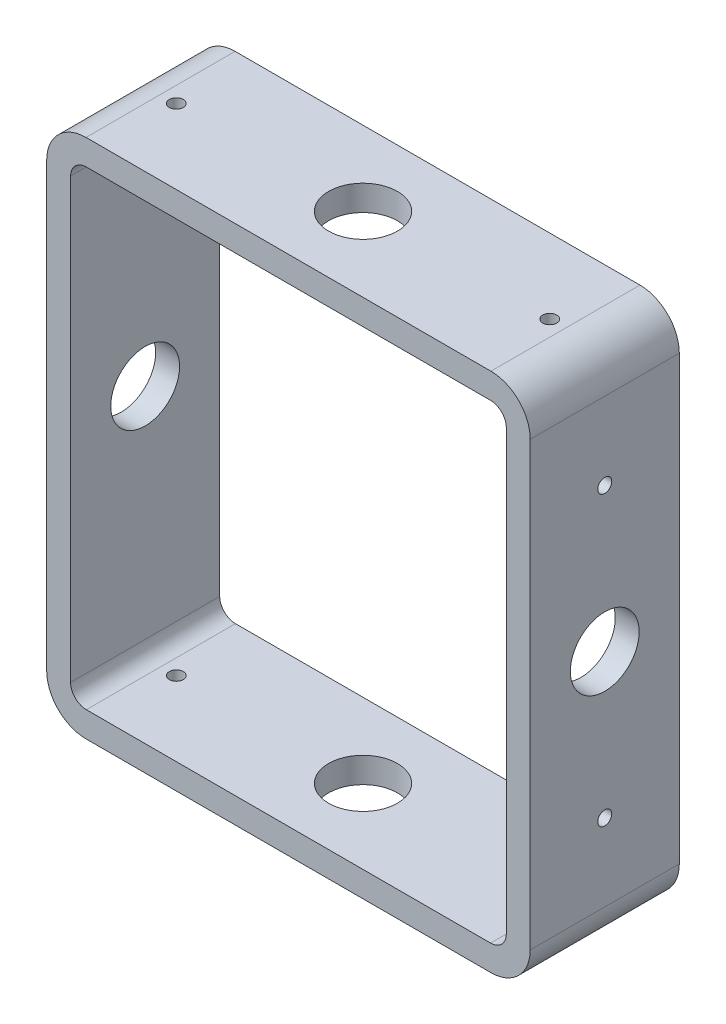
from build123d import *

# Parameters (mm, degrees)
SKETCH2_W                      = 78.0542
SKETCH2_H                      = 84.0867
SKETCH2_W_2                    = 70.3326
SKETCH2_H_2                    = 75.8698
BOSS_EXTRUDE1_DEPTH            = 24.0665
F_7_16_0_4375_DIAMETER_HOLE1_D = 11.1125
F_7_16_0_4375_DIAMETER_HOLE2_D = 11.1125
FILLET2_R                      = 6.35
FILLET3_R                      = 2.54
F_4_40_TAPPED_HOLE1_D          = 2.2606
F_4_40_TAPPED_HOLE1_DEPTH      = 3.8608
F_4_40_TAPPED_HOLE2_D          = 2.2606


with BuildPart() as part:
    # Sketch2 → Boss-Extrude1 (new body)
    with BuildSketch(Plane.XY):
        Rectangle(SKETCH2_W, SKETCH2_H)
        Rectangle(SKETCH2_W_2, SKETCH2_H_2, mode=Mode.SUBTRACT)
    extrude(amount=BOSS_EXTRUDE1_DEPTH)

    # 7/16 (0.4375) Diameter Hole1 (through all)
    with Locations(Plane.ZY.offset(39.0271)):
        with Locations((12.03325, 0)):
            Hole(F_7_16_0_4375_DIAMETER_HOLE1_D / 2)

    # 7/16 (0.4375) Diameter Hole2 (through all)
    with Locations(Plane(origin=(0, 42.04335, 0), x_dir=(1, 0, 0), z_dir=(0, 1, 0))):
        with Locations((0, -12.03325)):
            Hole(F_7_16_0_4375_DIAMETER_HOLE2_D / 2)

    # Fillet2
    fillet2_edges = [part.edges().sort_by_distance(p)[0] for p in [
        (39.0271, -42.04335, 12.03325),
        (-39.0271, -42.04335, 12.03325),
        (-39.0271, 42.04335, 12.03325),
        (39.0271, 42.04335, 12.03325),
    ]]
    fillet(fillet2_edges, radius=FILLET2_R)

    # Fillet3
    fillet3_edges = [part.edges().sort_by_distance(p)[0] for p in [
        (35.1663, -37.9349, 12.03325),
        (35.1663, 37.9349, 12.03325),
        (-35.1663, 37.9349, 12.03325),
        (-35.1663, -37.9349, 12.03325),
    ]]
    fillet(fillet3_edges, radius=FILLET3_R)

    # #4-40 Tapped Hole1
    with Locations(Plane(origin=(39.0271, 0, 0), x_dir=(0, 0, -1), z_dir=(1, 0, 0))):
        with Locations((-12.03325, 23.241), (-12.03325, -23.241)):
            Hole(F_4_40_TAPPED_HOLE1_D / 2, depth=F_4_40_TAPPED_HOLE1_DEPTH)

    # #4-40 Tapped Hole2 (through all)
    with Locations(Plane(origin=(0, -42.04335, 0), x_dir=(-1, 0, 0), z_dir=(0, -1, 0))):
        with Locations((-30.1371, -12.03325), (30.1371, -12.03325)):
            Hole(F_4_40_TAPPED_HOLE2_D / 2)


solid = part.part
